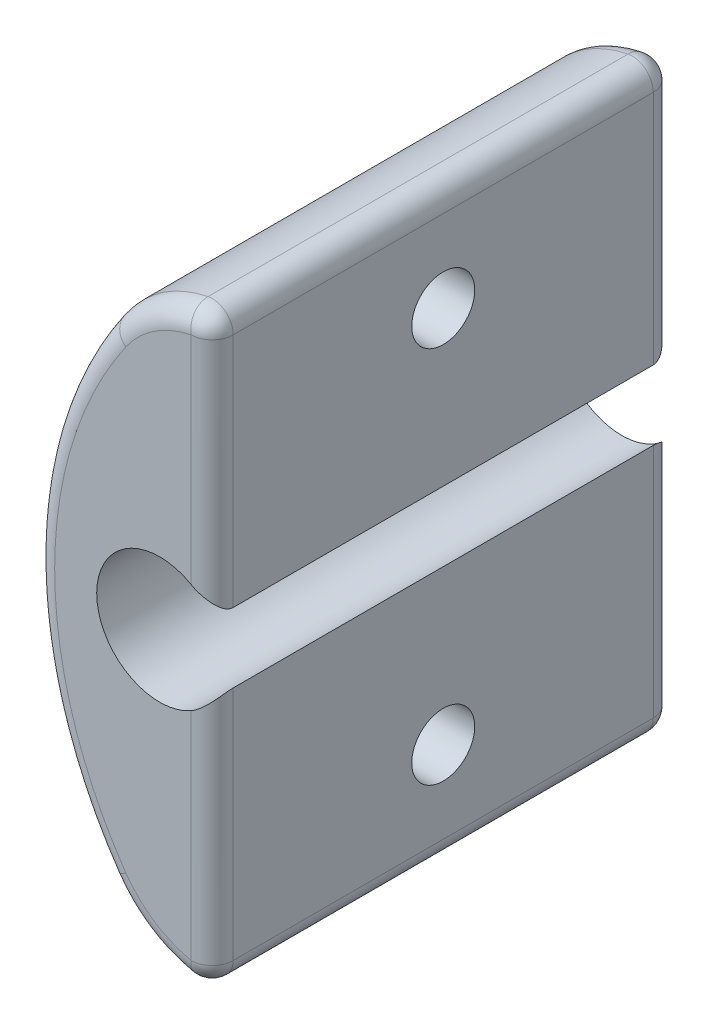
from build123d import *

# Parameters (mm, degrees)
BOSS_EXTRU_1_DEPTH = 11
CONG_1_R           = 1


with BuildPart() as part:
    # Esquisse1 → Boss.-Extru.1 (new, symmetric)
    with BuildSketch(Plane.XY):
        with BuildLine():
            Line((-3, 0), (-6, 0))
            ThreePointArc((-6, 0), (-5.08732356, 5.980413612), (-2.432384342, 11.416370107))
            ThreePointArc((-2.432384342, 11.416370107), (-0.284041968, 13.314989212), (2.5, 14))
            Line((2.5, 14), (2.5, 1.658312395))
            ThreePointArc((2.5, 1.658312395), (-0.866025404, 2.872281323), (-3, 0))
        make_face()
    extrude(amount=BOSS_EXTRU_1_DEPTH, both=True)

    # Esquisse2 → Enlèvement de matière-Révolution1 (revolve, cut)
    with BuildSketch(Plane.XY, mode=Mode.PRIVATE) as enl_vement_de_mati_re_r_volution1_sk:
        Polygon((2.5, 7.5), (-1.5, 7.5), (-1.5, 6), (-5.081191808, 6), (-5.081191808, 9), (2.5, 9), align=None)
    revolve(enl_vement_de_mati_re_r_volution1_sk.sketch.rotate(Axis((-5.081191808, 9, 0), (-1, 0, 0)), 180), axis=Axis((-5.081191808, 9, 0), (-1, 0, 0)), mode=Mode.SUBTRACT)

    # Congé1
    cong_1_edges = [part.edges().sort_by_distance(p)[0] for p in [
        (-0.284041968, 13.314989212, 11),
        (-5.08732356, 5.980413612, 11),
        (-5.08732356, 5.980413612, -11),
        (-0.284041968, 13.314989212, -11),
        (2.5, 7.829156198, -11),
        (2.5, 7.829156198, 11),
        (2.5, 14, 0),
    ]]
    fillet(cong_1_edges, radius=CONG_1_R)

    # Symétrie1: part across plane


with BuildPart() as part_1:
    add(part.part)
    add(part.part.mirror(Plane(origin=(-3, 0, 11), x_dir=(0, 0, 1), z_dir=(0, 1, 0))))


solid = part_1.part
